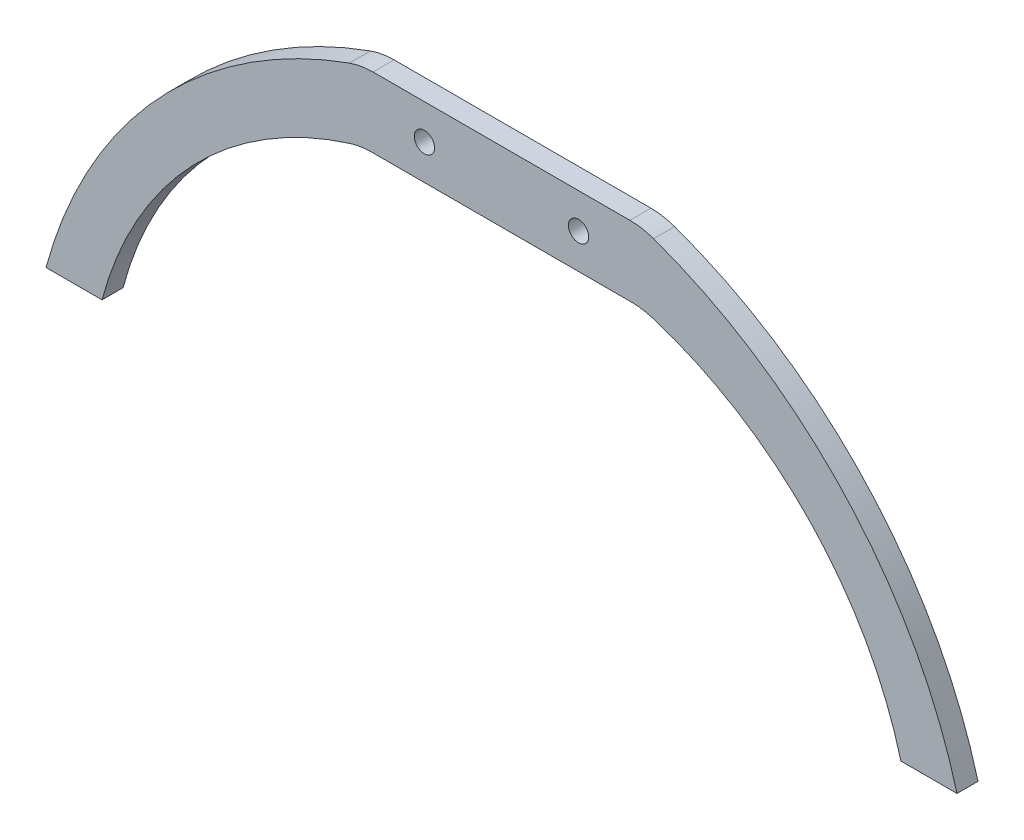
from build123d import *

# Parameters (mm, degrees)
EXTRUDE_1_DEPTH     = 3
SKETCH_3_R          = 1.45
CUT_EXTRUDE_2_DEPTH = 93.952945085
FILLET_1_R          = 10


with BuildPart() as part:
    # 草图1 → 凸台-拉伸1 (new body)
    with BuildSketch(Plane.XY):
        with BuildLine():
            Line((-45, -37.5), (-37, -37.5))
            ThreePointArc((-37, -37.5), (-23.489142232, -13.827379664), (0, 0))
            Line((0, 0), (40, 0))
            ThreePointArc((40, 0), (63.489142232, -13.827379664), (77, -37.5))
            Line((77, -37.5), (85, -37.5))
            ThreePointArc((85, -37.5), (68.488362784, -8.076814205), (40, 10))
            Line((40, 10), (0, 10))
            ThreePointArc((0, 10), (-28.488362784, -8.076814205), (-45, -37.5))
        make_face()
    extrude(amount=EXTRUDE_1_DEPTH)

    # 草图3 → 切除-拉伸2 (cut, through all)
    with BuildSketch(Plane.XY.offset(3)):
        with Locations((9, 5)):
            Circle(SKETCH_3_R)
        with Locations((31, 5)):
            Circle(SKETCH_3_R)
    extrude(amount=-CUT_EXTRUDE_2_DEPTH, mode=Mode.SUBTRACT)

    # 圆角1
    fillet_1_edges = [part.edges().sort_by_distance(p)[0] for p in [
        (0, 10, 1.5),
        (40, 10, 1.5),
        (40, 0, 1.5),
        (0, 0, 1.5),
    ]]
    fillet(fillet_1_edges, radius=FILLET_1_R)


solid = part.part
